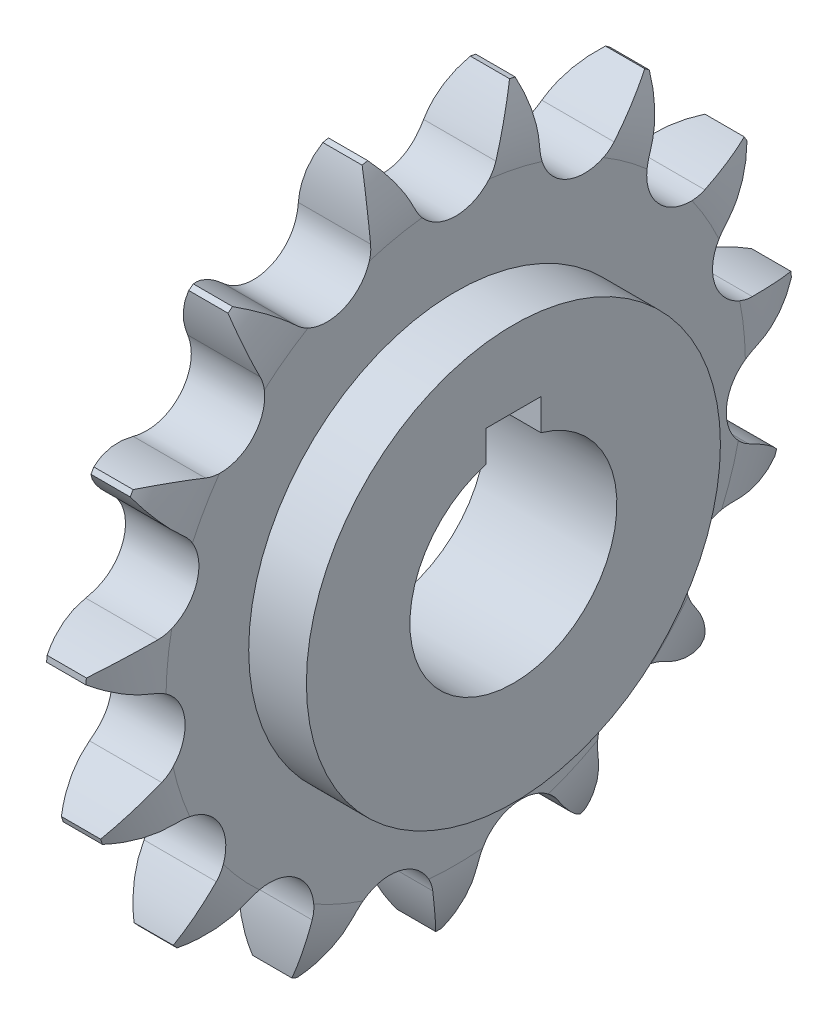
from build123d import *

# Parameters (mm, degrees)
TOOTHCUT_DEPTH      = 37.710811315
TEETHCUTS_COUNT     = 15
TEETHCUTS_ANGLE     = 336
BORSKE_R            = 5
BORE_DEPTH          = 50.0005
SKETCH1_R           = 15
SKETCH1_R_2         = 7.5
BOSS_EXTRUDE1_DEPTH = 24.6804
CUT_EXTRUDE2_START  = -18.5
SKETCH3_R           = 7.5
CUT_EXTRUDE2_DEPTH  = 18.5
SKETCH2_R           = 17.797607849
CUT_EXTRUDE1_DEPTH  = 20.5
SKETCH5_W           = 4
SKETCH5_H           = 4
CUT_EXTRUDE5_DEPTH  = 38.463204526


with BuildPart() as part:
    # BasProSke → Base-Revolve (revolve)
    with BuildSketch(Plane(origin=(0, 0, 0), x_dir=(1, 0, 0), z_dir=(0, 1, 0)), mode=Mode.PRIVATE) as base_revolve_sk:
        with BuildLine():
            Line((0, 0), (0, 20.988608354))
            ThreePointArc((0, 20.988608354), (0.314698702, 23.416771239), (1.238, 25.684484843))
            Line((1.238, 25.684484843), (4.0816, 25.684484843))
            ThreePointArc((4.0816, 25.684484843), (5.004901298, 23.416771239), (5.3196, 20.988608354))
            Line((5.3196, 20.988608354), (5.3196, 0))
            Line((5.3196, 0), (0, 0))
        make_face()
    revolve(base_revolve_sk.sketch.rotate(Axis((-10, 0, 0), (1, 0, 0)), 180), axis=Axis((-10, 0, 0), (1, 0, 0)))

    # TooCutSke → ToothCut (cut, through all)
    with BuildSketch(Plane(origin=(0, 0, 0), x_dir=(0, 0, -1), z_dir=(1, 0, 0))):
        with BuildLine():
            ThreePointArc((2.951828939, 21.685132796), (4.063020217, 23.756940993), (5.530366998, 25.593793922))
            ThreePointArc((5.530366998, 25.593793922), (0, 26.184484843), (-5.530366998, 25.593793922))
            ThreePointArc((-5.530366998, 25.593793922), (-4.063020217, 23.756940993), (-2.951828939, 21.685132796))
            ThreePointArc((-2.951828939, 21.685132796), (0, 19.731359843), (2.951828939, 21.685132796))
        make_face()
    toothcut = extrude(amount=TOOTHCUT_DEPTH, mode=Mode.SUBTRACT)

    # TeethCuts: ToothCut ×15 about axis
    teethcuts_axis = Axis((-10, 0, 0), (1, 0, 0))
    for i in range(1, TEETHCUTS_COUNT):
        add(toothcut.rotate(teethcuts_axis, i * TEETHCUTS_ANGLE / (TEETHCUTS_COUNT - 1)), mode=Mode.SUBTRACT)

    # BorSke → Bore (cut, symmetric)
    with BuildSketch(Plane(origin=(0, 0, 0), x_dir=(0, 0, -1), z_dir=(1, 0, 0))):
        with Locations(Location((0, 0, 0), (0, 0, 180))):
            Circle(BORSKE_R)
    extrude(amount=BORE_DEPTH, both=True, mode=Mode.SUBTRACT)

    # Sketch1 → Boss-Extrude1 (add)
    with BuildSketch(Plane(origin=(5.3196, 0, 0), x_dir=(0, 0, -1), z_dir=(1, 0, 0))):
        with Locations(Location((0, 0, 0), (0, 0, 180))):
            Circle(SKETCH1_R)
        Circle(SKETCH1_R_2, mode=Mode.SUBTRACT)
    extrude(amount=BOSS_EXTRUDE1_DEPTH)

    # Sketch3 → Cut-Extrude2 (cut)
    with BuildSketch(Plane(origin=(5.3196, 0, 0), x_dir=(0, 0, -1), z_dir=(1, 0, 0)).offset(CUT_EXTRUDE2_START)):
        Circle(SKETCH3_R)
    extrude(amount=CUT_EXTRUDE2_DEPTH, mode=Mode.SUBTRACT)

    # Sketch2 → Cut-Extrude1 (cut)
    with BuildSketch(Plane(origin=(30, 0, 0), x_dir=(0, 0, -1), z_dir=(1, 0, 0))):
        Circle(SKETCH2_R)
    extrude(amount=-CUT_EXTRUDE1_DEPTH, mode=Mode.SUBTRACT)

    # Sketch5 → Cut-Extrude5 (cut, through all)
    with BuildSketch(Plane(origin=(9.5, 0, 0), x_dir=(0, 0, -1), z_dir=(1, 0, 0))):
        with Locations((0, 7.5)):
            Rectangle(SKETCH5_W, SKETCH5_H)
    extrude(amount=-CUT_EXTRUDE5_DEPTH, mode=Mode.SUBTRACT)


solid = part.part
